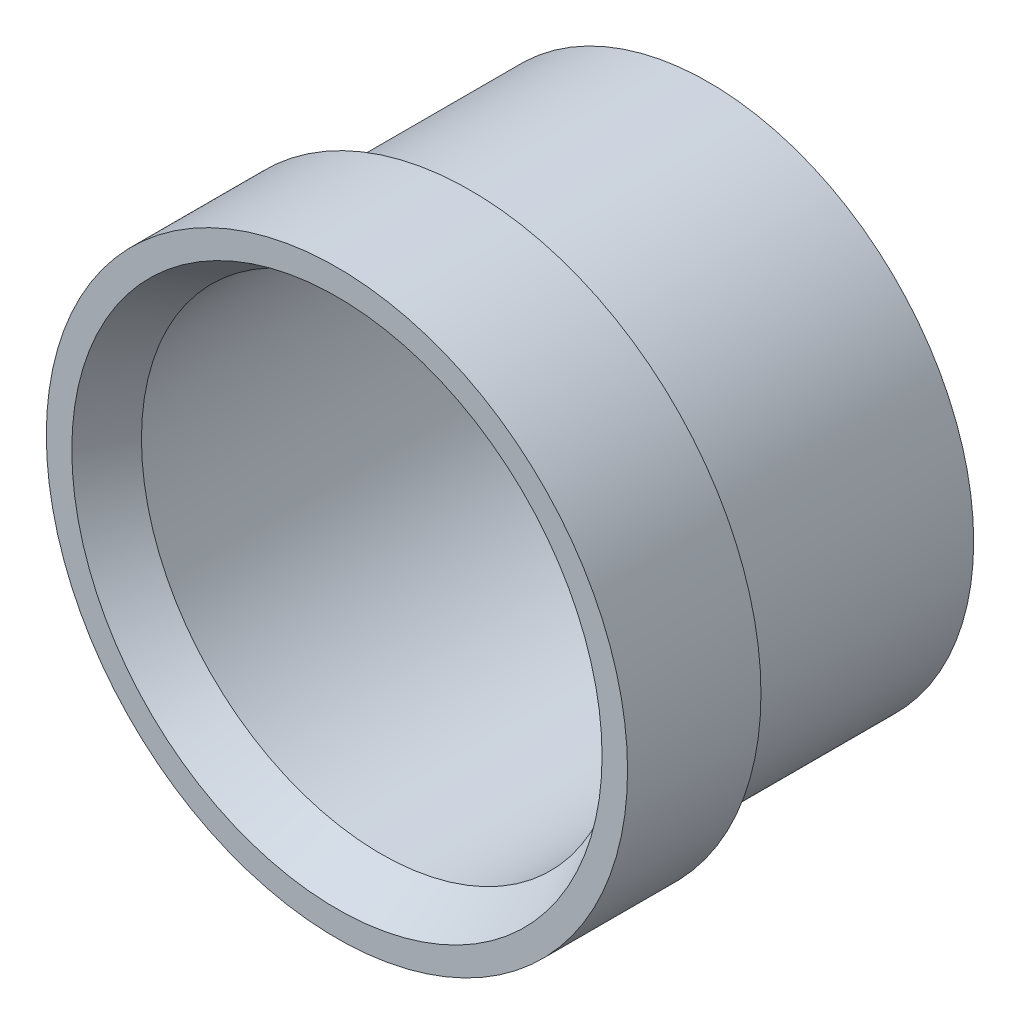
from build123d import *


with BuildPart() as part:
    # Sketch1 → Revolve1 (revolve)
    with BuildSketch(Plane(origin=(0, 0, 0), x_dir=(0, 0, -1), z_dir=(1, 0, 0)), mode=Mode.PRIVATE) as revolve1_sk:
        Polygon((-9.906, 14.1351), (-7.552316158, 12.7762), (9.906, 12.7762), (9.906, 14.1351), (-2.794, 14.1351), (-2.794, 15.494), (-9.906, 15.494), align=None)
    revolve(revolve1_sk.sketch.rotate(Axis((0, 0, -9.906), (0, 0, 1)), 90), axis=Axis((0, 0, -9.906), (0, 0, 1)))


solid = part.part
